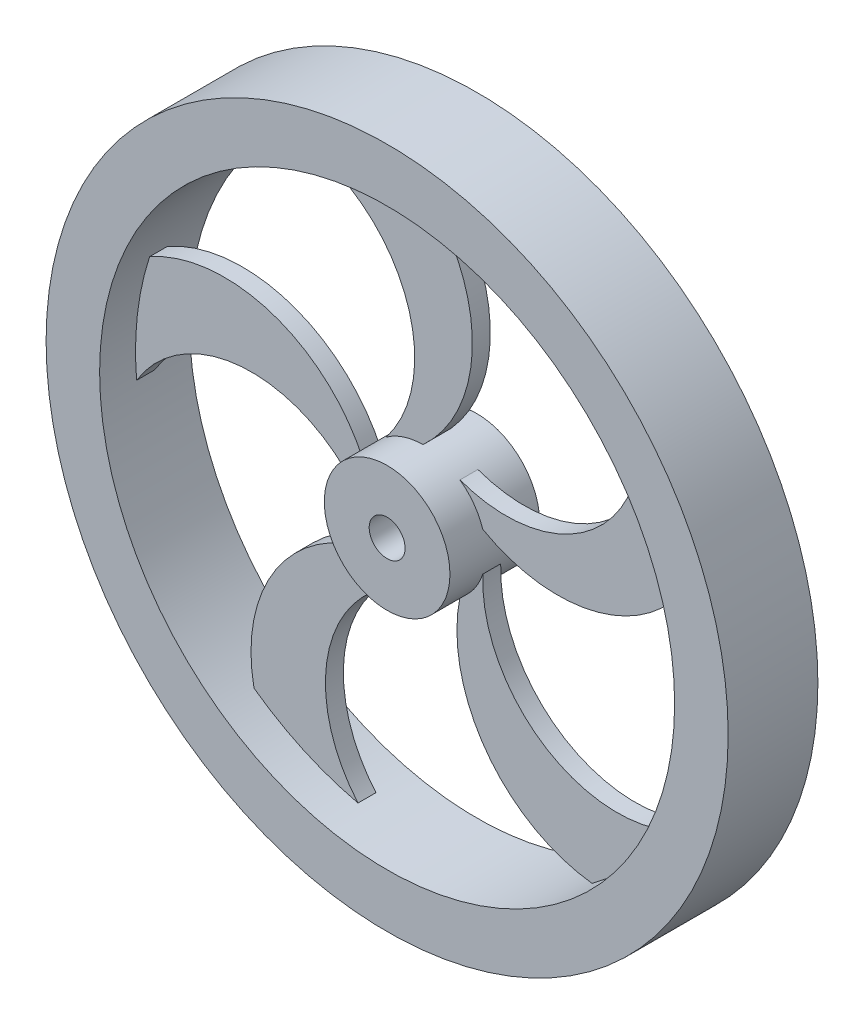
from build123d import *

# Parameters (mm, degrees)
SKETCH1_R             = 7
SKETCH1_R_2           = 2
BOSS_EXTRUDE1_DEPTH   = 5
SKETCH1_R_3           = 38
SKETCH1_R_4           = 32.036519423
BOSS_EXTRUDE1_2_DEPTH = 5
BOSS_EXTRUDE2_DEPTH   = 1


with BuildPart() as part:
    # Sketch1 → Boss-Extrude1 (new, symmetric)
    with BuildSketch(Plane.XY):
        Circle(SKETCH1_R)
        Circle(SKETCH1_R_2, mode=Mode.SUBTRACT)
    extrude(amount=BOSS_EXTRUDE1_DEPTH, both=True)



with BuildPart() as body_2:
    # Sketch1 → Boss-Extrude1 2 (new, symmetric)
    with BuildSketch(Plane.XY):
        Circle(SKETCH1_R_3)
        Circle(SKETCH1_R_4, mode=Mode.SUBTRACT)
    extrude(amount=BOSS_EXTRUDE1_2_DEPTH, both=True)


with BuildPart() as part_1:
    add(part.part)

    add(body_2.part)  # Boss-Extrude2 merges body 2
    # Sketch1<4> → Boss-Extrude2 (add, symmetric)
    with BuildSketch(Plane.XY):
        with BuildLine():
            ThreePointArc((4.118865652, 5.659942203), (5.664706075, 4.112311404), (6.657395614, 2.163118961))
            ThreePointArc((6.657395614, 2.163118961), (20.261981539, 0.802448215), (30.468540556, 9.899828942))
            ThreePointArc((30.468540556, 9.899828942), (27.892934581, 15.758260601), (24.20429022, 20.987875349))
            ThreePointArc((24.20429022, 20.987875349), (18.355139249, 7.828747841), (4.118865652, 5.659942203))
        make_face()
        with BuildLine():
            ThreePointArc((27.440192629, -16.534037778), (13.117631611, -15.037558663), (6.655724398, -2.16825569))
            ThreePointArc((6.655724398, -2.16825569), (5.661531003, -4.116681515), (4.114496766, -5.663118961))
            ThreePointArc((4.114496766, -5.663118961), (7.024470239, -19.02231944), (18.830593651, -25.918088654))
            ThreePointArc((18.830593651, -25.918088654), (23.606387238, -21.658186865), (27.440192629, -16.534037778))
        make_face()
        with BuildLine():
            ThreePointArc((-4.11012543, 5.666292346), (-2.160550113, 6.658229736), (0, 7))
            ThreePointArc((0, 7), (5.498123031, 19.518259711), (0, 32.036519423))
            ThreePointArc((0, 32.036519423), (-6.367605621, 31.39732752), (-12.481118599, 29.505258095))
            ThreePointArc((-12.481118599, 29.505258095), (-1.773531687, 19.875990918), (-4.11012543, 5.666292346))
        make_face()
        with BuildLine():
            ThreePointArc((-7.245318518, -31.206472667), (-10.247997062, -17.122470203), (-0.005401754, -6.999997916))
            ThreePointArc((-0.005401754, -6.999997916), (-2.165687487, -6.656560502), (-4.114496766, -5.663118961))
            ThreePointArc((-4.114496766, -5.663118961), (-15.920620178, -12.558888174), (-18.830593651, -25.918088654))
            ThreePointArc((-18.830593651, -25.918088654), (-13.303384916, -29.143756218), (-7.245318518, -31.206472667))
        make_face()
        with BuildLine():
            ThreePointArc((-6.659062866, -2.157980943), (-6.999999479, 0.002700877), (-6.657395614, 2.163118961))
            ThreePointArc((-6.657395614, 2.163118961), (-16.863954631, 11.260499688), (-30.468540556, 9.899828942))
            ThreePointArc((-30.468540556, 9.899828942), (-31.828331282, 3.646354962), (-31.918045732, -2.752622999))
            ThreePointArc((-31.918045732, -2.752622999), (-19.451242112, 4.455290106), (-6.659062866, -2.157980943))
        make_face()
    extrude(amount=BOSS_EXTRUDE2_DEPTH, both=True)


solid = part_1.part
